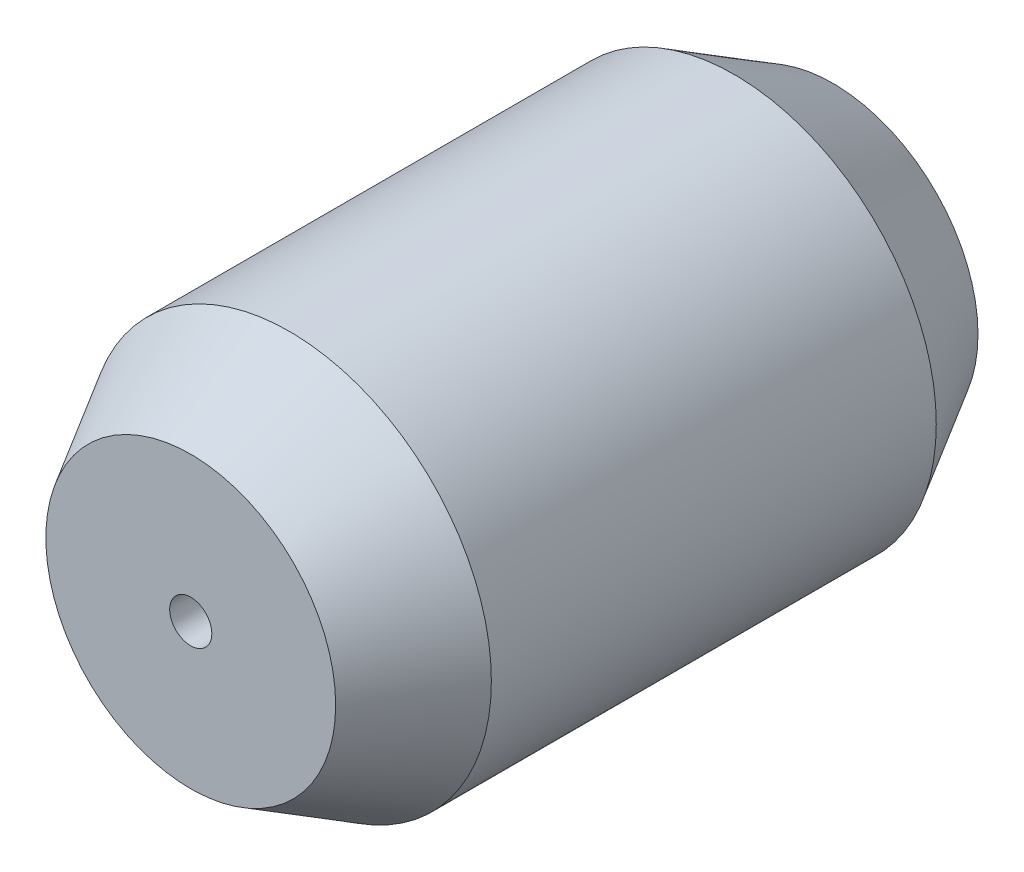
from build123d import *

# Parameters (mm, degrees)
BOSS_EXTRUDE1_DEPTH      = 15.494
BOSS_EXTRUDE1_DEPTH_BACK = 15.494
SKETCH1_R                = 9.7409
SKETCH1_R_2              = 1.016
CHAMFER2_SIZE            = 4.7625
CHAMFER2_SIZE2           = 2.749630657
CHAMFER3_SIZE            = 4.7625
CHAMFER3_SIZE2           = 2.749630657


with BuildPart() as part:
    # Sketch1 → Boss-Extrude1 (new, two sides: drawn at the far end of the back side and taken through both)
    with BuildSketch(Plane.XY.offset(-BOSS_EXTRUDE1_DEPTH_BACK)):
        Circle(SKETCH1_R)
        Circle(SKETCH1_R_2, mode=Mode.SUBTRACT)
    extrude(amount=BOSS_EXTRUDE1_DEPTH + BOSS_EXTRUDE1_DEPTH_BACK)

    # Chamfer2
    chamfer2_edges = [part.edges().sort_by_distance(p)[0] for p in [
        (-9.7409, 0, -15.494),
    ]]
    chamfer2_side = [part.faces().sort_by_distance(p)[0] for p in [
        (-9.7409, 0, -7.747),
    ]]
    chamfer(chamfer2_edges, length=CHAMFER2_SIZE, length2=CHAMFER2_SIZE2, reference=chamfer2_side[0])

    # Chamfer3
    chamfer3_edges = [part.edges().sort_by_distance(p)[0] for p in [
        (-9.7409, 0, 15.494),
    ]]
    chamfer3_side = [part.faces().sort_by_distance(p)[0] for p in [
        (-9.7409, 0, 2.38125),
    ]]
    chamfer(chamfer3_edges, length=CHAMFER3_SIZE, length2=CHAMFER3_SIZE2, reference=chamfer3_side[0])


solid = part.part
